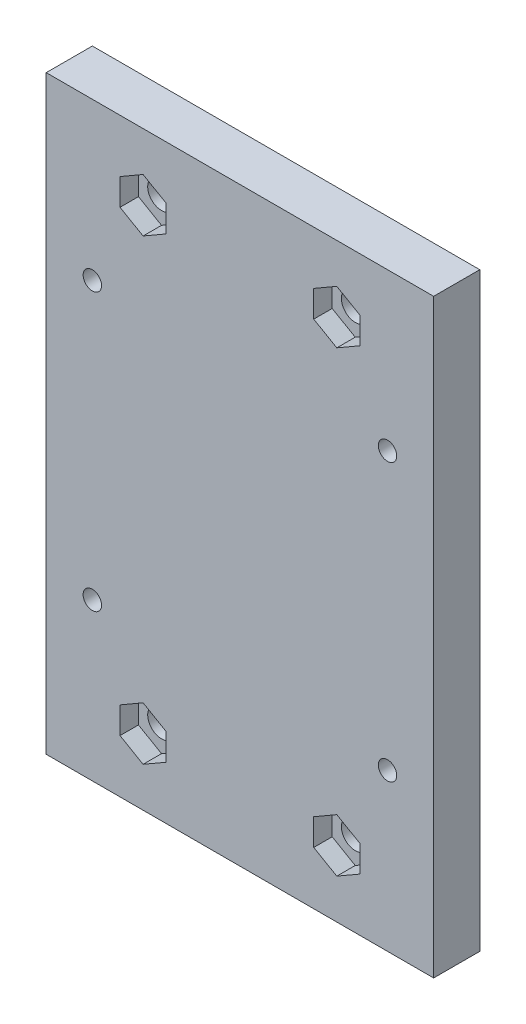
from build123d import *

# Parameters (mm, degrees)
SKETCH_1_W          = 42
SKETCH_1_H          = 64
EXTRUDE_1_DEPTH     = 5
CUT_EXTRUDE_1_DEPTH = 2
SKETCH_4_R          = 1.5
CUT_EXTRUDE_2_DEPTH = 77.609398901
SKETCH_5_R          = 1
CUT_EXTRUDE_3_DEPTH = 5


with BuildPart() as part:
    # 스케치1 → 보스-돌출1 (new body)
    with BuildSketch(Plane.XY):
        with Locations((21, -32)):
            Rectangle(SKETCH_1_W, SKETCH_1_H)
    extrude(amount=EXTRUDE_1_DEPTH)

    # 스케치2 → 컷-돌출1 (cut)
    with BuildSketch(Plane.XY.offset(5)):
        Polygon((10.5, -4.313248654), (10.5, -10.086751346), (8, -8.643375673), (8, -5.756624327), align=None)
        Polygon((13, -5.756624327), (10.5, -4.313248654), (10.5, -10.086751346), (13, -8.643375673), align=None)
        Polygon((31.5, -4.313248654), (31.5, -10.086751346), (29, -8.643375673), (29, -5.756624327), align=None)
        Polygon((34, -5.756624327), (31.5, -4.313248654), (31.5, -10.086751346), (34, -8.643375673), align=None)
        Polygon((10.5, -53.913248654), (10.5, -59.686751346), (8, -58.243375673), (8, -55.356624327), align=None)
        Polygon((13, -55.356624327), (10.5, -53.913248654), (10.5, -59.686751346), (13, -58.243375673), align=None)
        Polygon((31.5, -53.913248654), (31.5, -59.686751346), (29, -58.243375673), (29, -55.356624327), align=None)
        Polygon((34, -55.356624327), (31.5, -53.913248654), (31.5, -59.686751346), (34, -58.243375673), align=None)
    extrude(amount=-CUT_EXTRUDE_1_DEPTH, mode=Mode.SUBTRACT)

    # 스케치4 → 컷-돌출2 (cut, through all)
    with BuildSketch(Plane.XY.offset(3)):
        with Locations((10.5, -7.2)):
            Circle(SKETCH_4_R)
        with Locations((31.5, -7.2)):
            Circle(SKETCH_4_R)
        with Locations((31.5, -56.8)):
            Circle(SKETCH_4_R)
        with Locations((10.5, -56.8)):
            Circle(SKETCH_4_R)
    extrude(amount=-CUT_EXTRUDE_2_DEPTH, mode=Mode.SUBTRACT)

    # 스케치5 → 컷-돌출3 (cut)
    with BuildSketch(Plane.XY.offset(5)):
        with Locations((5, -17)):
            Circle(SKETCH_5_R)
        with Locations((37, -17)):
            Circle(SKETCH_5_R)
        with Locations((5, -47)):
            Circle(SKETCH_5_R)
        with Locations((37, -47)):
            Circle(SKETCH_5_R)
    extrude(amount=-CUT_EXTRUDE_3_DEPTH, mode=Mode.SUBTRACT)


solid = part.part
